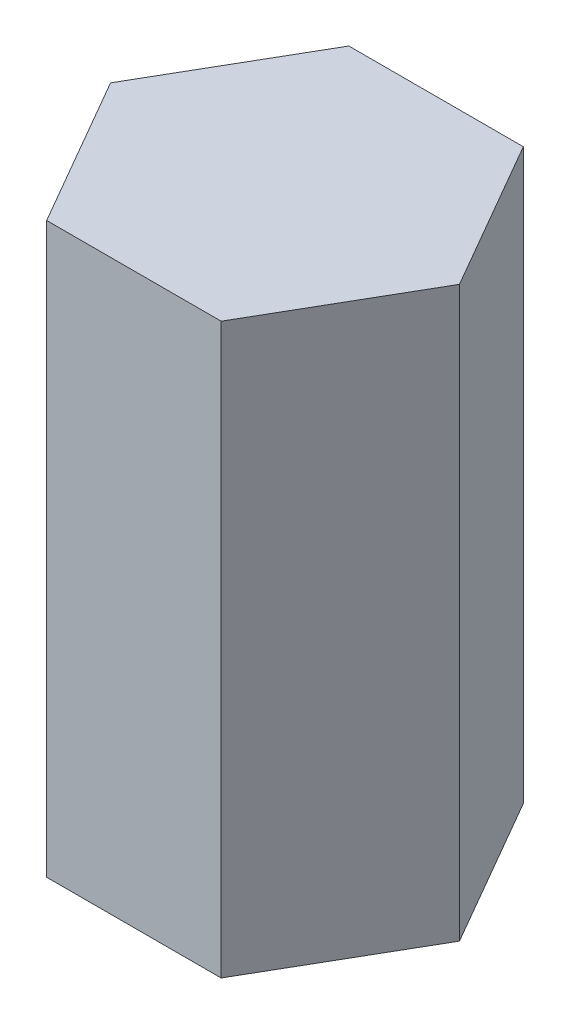
from build123d import *

# Parameters (mm, degrees)
BOSS_EXTRUDE1_DEPTH = 32


with BuildPart() as part:
    # Sketch1 → Boss-Extrude1 (new body)
    with BuildSketch(Plane(origin=(0, 0, 0), x_dir=(1, 0, 0), z_dir=(0, 1, 0))):
        Polygon((9.814954576, 0), (4.907477288, 8.5), (-4.907477288, 8.5), (-9.814954576, 0), (-4.907477288, -8.5), (4.907477288, -8.5), align=None)
    extrude(amount=BOSS_EXTRUDE1_DEPTH)


solid = part.part
